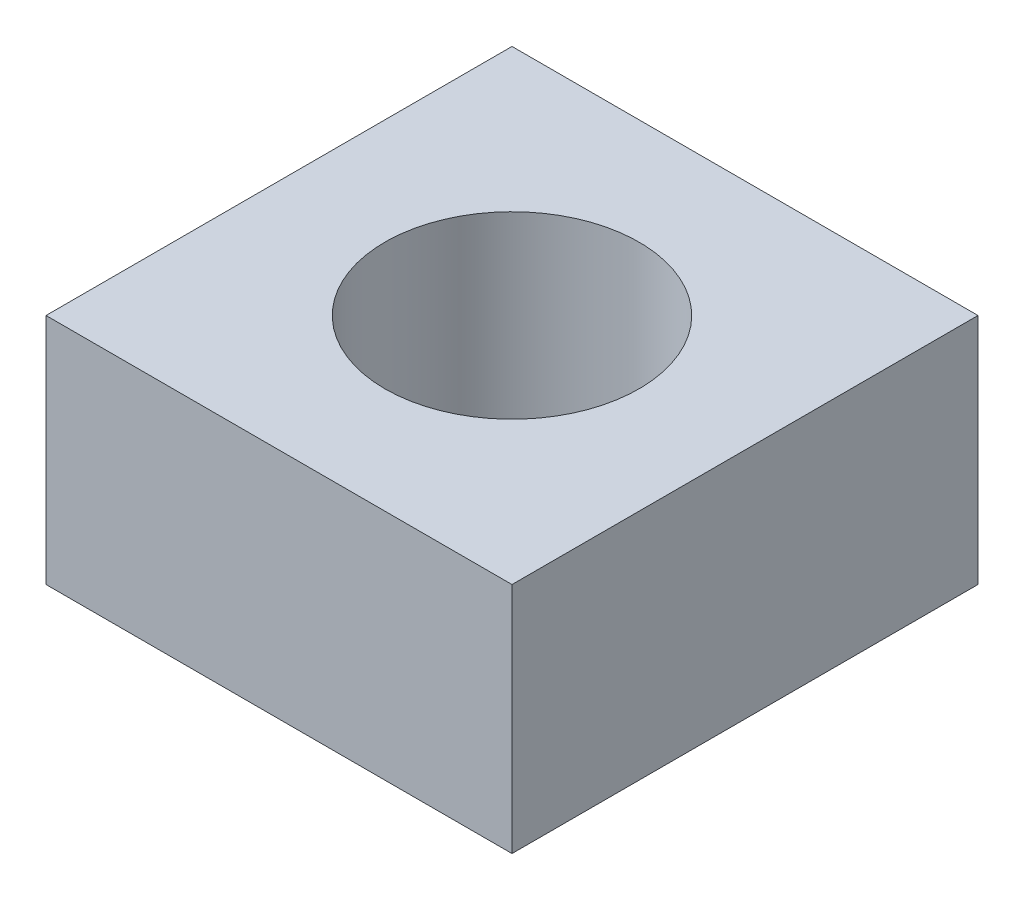
from build123d import *

# Parameters (mm, degrees)
SKETCH1_W           = 11
SKETCH1_H           = 11
SKETCH1_R           = 3
BOSS_EXTRUDE1_DEPTH = 5.5


with BuildPart() as part:
    # Sketch1 → Boss-Extrude1 (new body)
    with BuildSketch(Plane(origin=(0, 0, 0), x_dir=(1, 0, 0), z_dir=(0, 1, 0))):
        Rectangle(SKETCH1_W, SKETCH1_H)
        with Locations(Location((0, 0, 0), (0, 0, 270))):
            Circle(SKETCH1_R, mode=Mode.SUBTRACT)
    extrude(amount=BOSS_EXTRUDE1_DEPTH)


solid = part.part
